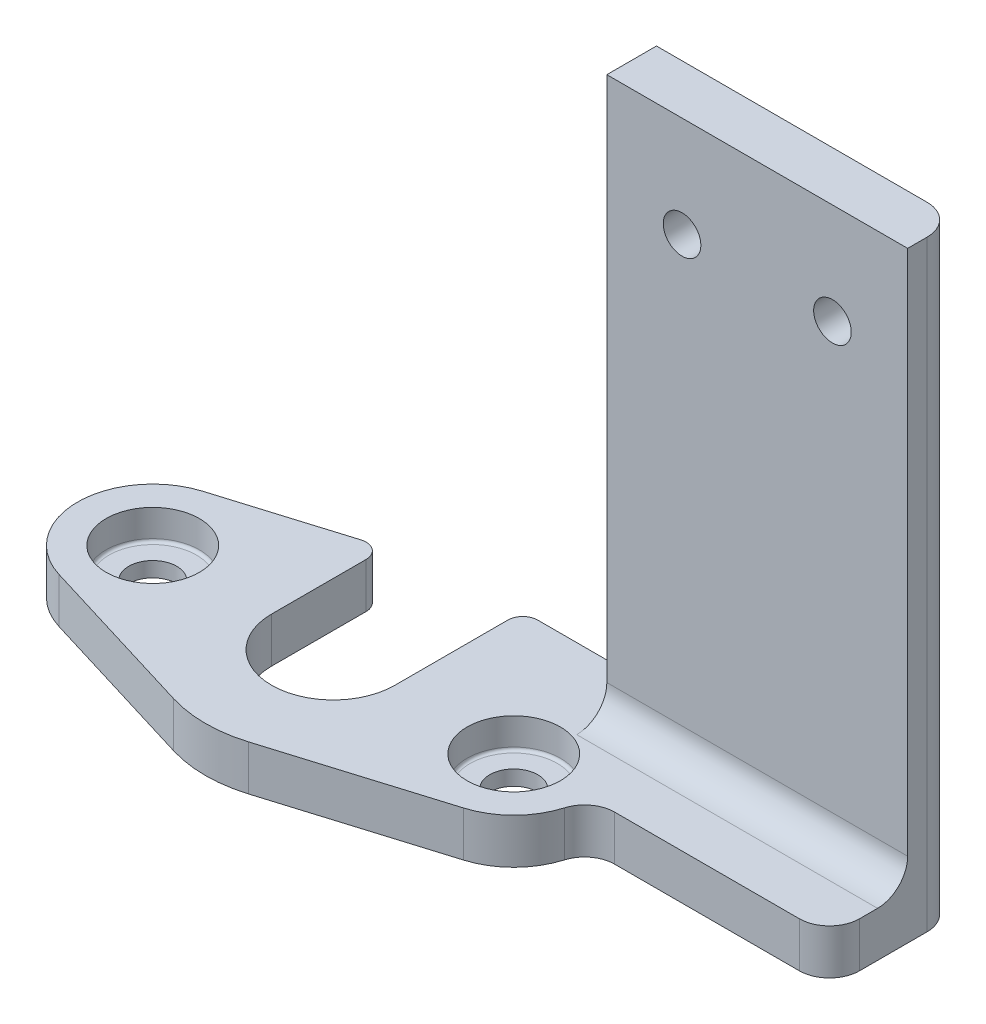
from build123d import *

# Parameters (mm, degrees)
SKETCH_1_R          = 1.6
EXTRUDE_1_DEPTH     = 3
SKETCH_2_R          = 3.1
CUT_EXTRUDE_1_DEPTH = 2
FILLET_1_R          = 0.2
SKETCH_4_W          = 20
SKETCH_4_H          = 3.3
EXTRUDE_2_DEPTH     = 37
FILLET_2_R          = 2
SKETCH_5_R          = 1.25
CUT_EXTRUDE_2_DEPTH = 3.3


with BuildPart() as part:
    # Эскиз1 → Бобышка-Вытянуть1 (new body)
    with BuildSketch(Plane(origin=(0, -18, 0), x_dir=(1, 0, 0), z_dir=(0, 1, 0))):
        with BuildLine():
            Line((9.520833333, 86.731463811), (-1.458333333, 90.079283893))
            ThreePointArc((-1.458333333, 90.079283893), (-5, 94.861884011), (-1.458333333, 99.644484129))
            Line((-1.458333333, 99.644484129), (6.608333333, 102.104210763))
            ThreePointArc((6.608333333, 102.104210763), (7.495119036, 101.951328303), (7.9, 101.14769074))
            Line((7.9, 101.14769074), (7.9, 94.861884011))
            ThreePointArc((7.9, 94.861884011), (12, 90.761884011), (16.1, 94.861884011))
            Line((16.1, 94.861884011), (16.1, 102.361884011))
            ThreePointArc((16.1, 102.361884011), (16.392893219, 103.068990793), (17.1, 103.361884011))
            Line((17.1, 103.361884011), (44.988630488, 103.361884011))
            Line((44.988630488, 103.361884011), (44.988630488, 94.861884011))
            Line((44.988630488, 94.861884011), (29, 94.861884011))
            ThreePointArc((29, 94.861884011), (28.018187817, 91.886288833), (25.458333333, 90.079283893))
            Line((25.458333333, 90.079283893), (14.479166667, 86.731463811))
            ThreePointArc((14.479166667, 86.731463811), (12, 86.361884011), (9.520833333, 86.731463811))
        make_face()
        with Locations(Location((24, 94.861884011, 0), (0, 0, 270))):
            Circle(SKETCH_1_R, mode=Mode.SUBTRACT)
        with Locations(Location((0, 94.861884011, 0), (0, 0, 270))):
            Circle(SKETCH_1_R, mode=Mode.SUBTRACT)
    extrude(amount=EXTRUDE_1_DEPTH)

    # Эскиз2 → Вырез-Вытянуть1 (cut)
    with BuildSketch(Plane(origin=(0, -15, 0), x_dir=(1, 0, 0), z_dir=(0, 1, 0))):
        with Locations(Location((0, 94.861884011, 0), (0, 0, 270))):
            Circle(SKETCH_2_R)
        with Locations(Location((24, 94.861884011, 0), (0, 0, 270))):
            Circle(SKETCH_2_R)
    extrude(amount=-CUT_EXTRUDE_1_DEPTH, mode=Mode.SUBTRACT)

    # Скругление1
    fillet_1_edges = [part.edges().sort_by_distance(p)[0] for p in [
        (0, -17, -97.961884011),
        (24, -17, -97.961884011),
    ]]
    fillet(fillet_1_edges, radius=FILLET_1_R)

    # Эскиз4 → Бобышка-Вытянуть2 (add)
    with BuildSketch(Plane(origin=(0, -15, 0), x_dir=(1, 0, 0), z_dir=(0, 1, 0))):
        with Locations((34.988630488, 101.711884011)):
            Rectangle(SKETCH_4_W, SKETCH_4_H)
    extrude(amount=EXTRUDE_2_DEPTH)

    # Скругление2
    fillet_2_edges = [part.edges().sort_by_distance(p)[0] for p in [
        (44.988630488, 2, -103.361884011),
        (44.988630488, -16.5, -94.861884011),
        (29, -16.5, -94.861884011),
        (34.988630488, -15, -100.061884011),
    ]]
    fillet(fillet_2_edges, radius=FILLET_2_R)

    # Эскиз5 → Вырез-Вытянуть2 (cut)
    with BuildSketch(Plane.XY.offset(-100.061884011)):
        with Locations((39.988630488, 15.3)):
            Circle(SKETCH_5_R)
        with Locations((29.988630488, 15.3)):
            Circle(SKETCH_5_R)
    extrude(amount=-CUT_EXTRUDE_2_DEPTH, mode=Mode.SUBTRACT)


solid = part.part
